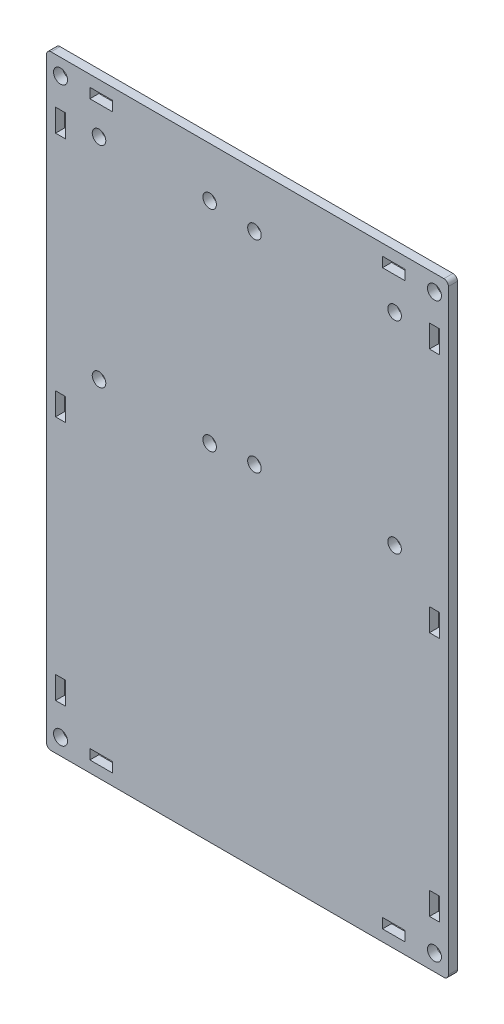
from build123d import *

# Parameters (mm, degrees)
SKETCH1_W           = 89
SKETCH1_H           = 134
SKETCH1_R           = 1.5
SKETCH1_R_2         = 1.55
SKETCH1_W_2         = 2.2
SKETCH1_H_2         = 5
SKETCH1_W_3         = 5
SKETCH1_H_3         = 2.2
BOSS_EXTRUDE1_DEPTH = 2
FILLET1_R           = 1


with BuildPart() as part:
    # Sketch1 → Boss-Extrude1 (new body)
    with BuildSketch(Plane.XY):
        Rectangle(SKETCH1_W, SKETCH1_H)
        with Locations((-32.88, 56)):
            Circle(SKETCH1_R, mode=Mode.SUBTRACT)
        with Locations((-8.38, 56)):
            Circle(SKETCH1_R, mode=Mode.SUBTRACT)
        with Locations((-32.88, 9.5)):
            Circle(SKETCH1_R, mode=Mode.SUBTRACT)
        with Locations((-8.38, 9.5)):
            Circle(SKETCH1_R, mode=Mode.SUBTRACT)
        with Locations((1.54, 55.08)):
            Circle(SKETCH1_R, mode=Mode.SUBTRACT)
        with Locations((32.58, 55.08)):
            Circle(SKETCH1_R, mode=Mode.SUBTRACT)
        with Locations((1.54, 10.38)):
            Circle(SKETCH1_R, mode=Mode.SUBTRACT)
        with Locations((32.58, 10.38)):
            Circle(SKETCH1_R, mode=Mode.SUBTRACT)
        with Locations((-41.4, 63.4)):
            Circle(SKETCH1_R_2, mode=Mode.SUBTRACT)
        with Locations(Location((-41.4, -63.4, 0), (0, 0, 180))):
            Circle(SKETCH1_R_2, mode=Mode.SUBTRACT)
        with Locations((41.4, -63.4)):
            Circle(SKETCH1_R_2, mode=Mode.SUBTRACT)
        with Locations(Location((41.4, 63.4, 0), (0, 0, 180))):
            Circle(SKETCH1_R_2, mode=Mode.SUBTRACT)
        with Locations((-41.4, 0)):
            Rectangle(SKETCH1_W_2, SKETCH1_H_2, mode=Mode.SUBTRACT)
        with Locations((-41.4, -54.4)):
            Rectangle(SKETCH1_W_2, SKETCH1_H_2, mode=Mode.SUBTRACT)
        with Locations((-41.4, 54.4)):
            Rectangle(SKETCH1_W_2, SKETCH1_H_2, mode=Mode.SUBTRACT)
        with Locations((41.4, 54.4)):
            Rectangle(SKETCH1_W_2, SKETCH1_H_2, mode=Mode.SUBTRACT)
        with Locations((41.4, -54.4)):
            Rectangle(SKETCH1_W_2, SKETCH1_H_2, mode=Mode.SUBTRACT)
        with Locations((41.4, 0)):
            Rectangle(SKETCH1_W_2, SKETCH1_H_2, mode=Mode.SUBTRACT)
        with Locations((32.4, 63.4)):
            Rectangle(SKETCH1_W_3, SKETCH1_H_3, mode=Mode.SUBTRACT)
        with Locations((-32.4, 63.4)):
            Rectangle(SKETCH1_W_3, SKETCH1_H_3, mode=Mode.SUBTRACT)
        with Locations((32.4, -63.4)):
            Rectangle(SKETCH1_W_3, SKETCH1_H_3, mode=Mode.SUBTRACT)
        with Locations((-32.4, -63.4)):
            Rectangle(SKETCH1_W_3, SKETCH1_H_3, mode=Mode.SUBTRACT)
    extrude(amount=BOSS_EXTRUDE1_DEPTH)

    # Fillet1
    fillet1_edges = [part.edges().sort_by_distance(p)[0] for p in [
        (44.5, -67, 1),
        (-44.5, -67, 1),
        (-44.5, 67, 1),
        (44.5, 67, 1),
    ]]
    fillet(fillet1_edges, radius=FILLET1_R)


solid = part.part
